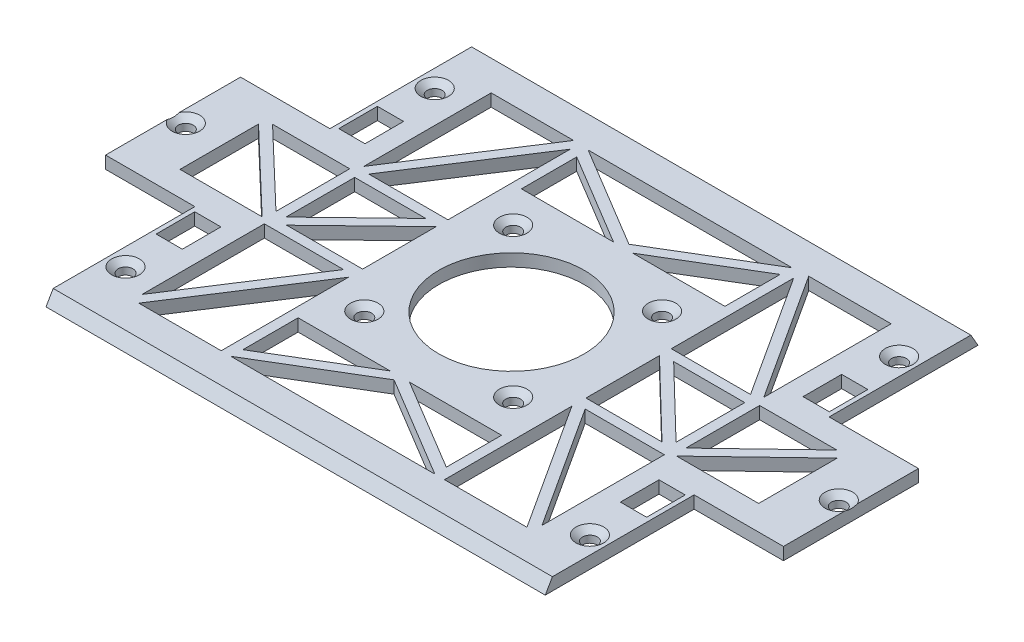
from build123d import *

# Parameters (mm, degrees)
SKETCH1_R                                         = 18.5801
BOSS_EXTRUDE1_DEPTH                               = 3.175
CSK_FOR_6_FLAT_HEAD_MACHINE_SCREW_100_D           = 3.7973
CSK_FOR_6_FLAT_HEAD_MACHINE_SCREW_100_CSINK_D     = 7.0866
CSK_FOR_6_FLAT_HEAD_MACHINE_SCREW_100_CSINK_ANGLE = 100
CUT_EXTRUDE2_DEPTH                                = 114.138623562
SKETCH7_W                                         = 6.7056
SKETCH7_H                                         = 9.8806
CUT_EXTRUDE5_DEPTH                                = 114.138623562


with BuildPart() as part:
    # Sketch1 → Boss-Extrude1 (new body)
    with BuildSketch(Plane(origin=(0, 0, 0), x_dir=(1, 0, 0), z_dir=(0, 1, 0))):
        Polygon((-65.455327335, 70.644677608), (62.306672665, 70.644677608), (62.306672665, 32.544677608), (85.166672665, 32.544677608), (85.166672665, -1.999322392), (62.306672665, -1.999322392), (62.306672665, -40.099322392), (-65.455327335, -40.099322392), (-65.455327335, -1.999322392), (-88.315327335, -1.999322392), (-88.315327335, 32.544677608), (-65.455327335, 32.544677608), align=None)
        with Locations(Location((-1.574327335, 15.145677608, 0), (0, 0, 270))):
            Circle(SKETCH1_R, mode=Mode.SUBTRACT)
    extrude(amount=BOSS_EXTRUDE1_DEPTH)

    # CSK for #6 Flat Head Machine Screw (100)1 (through all)
    with Locations(Plane(origin=(0, 3.175, 0), x_dir=(1, 0, 0), z_dir=(0, 1, 0))):
        with Locations((-60.978577335, 54.896669208), (-85.108577335, 15.336169208), (-60.978577335, -24.224330792), (57.861672665, -24.224322392), (81.991672665, 15.336177608), (57.861672665, 54.896677608), (-20.608452335, 34.608427608), (-20.608452335, -3.491572392), (17.491547665, -3.491572392), (17.491547665, 34.608427608)):
            CounterSinkHole(CSK_FOR_6_FLAT_HEAD_MACHINE_SCREW_100_D / 2, CSK_FOR_6_FLAT_HEAD_MACHINE_SCREW_100_CSINK_D / 2, counter_sink_angle=CSK_FOR_6_FLAT_HEAD_MACHINE_SCREW_100_CSINK_ANGLE)

    # Sketch4 → Cut-Extrude2 (cut, symmetric)
    with BuildSketch(Plane(origin=(0, 0, 0), x_dir=(0, 0, -1), z_dir=(1, 0, 0))):
        Polygon((70.644677608, 0), (68.811590503, 3.175), (70.644677608, 3.175), align=None)
    cut_extrude2 = extrude(amount=CUT_EXTRUDE2_DEPTH, both=True, mode=Mode.SUBTRACT)

    # Mirror1: Cut-Extrude2 across plane
    add(cut_extrude2.mirror(Plane.XY.offset(-15.272677608)), mode=Mode.SUBTRACT)

    # Sketch7 → Cut-Extrude5 (cut, through all)
    with BuildSketch(Plane(origin=(0, 3.175, 0), x_dir=(1, 0, 0), z_dir=(0, 1, 0))):
        Polygon((-31.662153757, 61.119677608), (-52.755327335, 61.119677608), (-52.755327335, 28.53190944), align=None)
        Polygon((-30.149327335, 58.782445776), (-50.420464549, 27.464677608), (-30.149327335, 27.464677608), align=None)
        Polygon((-54.025327335, 7.320825628), (-54.025327335, 26.194677608), (-73.777032895, 26.194677608), align=None)
        Polygon((-27.609327335, 60.865677608), (-27.609327335, 60.822739389), (-1.574327335, 45.201739389), (-1.574327335, 60.865677608), align=None)
        Polygon((-30.149327335, 5.620677608), (-30.149327335, 24.428637467), (-49.613378817, 5.620677608), align=None)
        Polygon((-33.291275852, 24.924677608), (-51.485327335, 24.924677608), (-51.485327335, 7.34390876), align=None)
        Polygon((-27.609327335, 57.860615827), (-27.609327335, 43.720677608), (-4.042763637, 43.720677608), align=None)
        Polygon((-54.593621774, 4.350677608), (-75.615327335, 24.438085143), (-75.615327335, 4.350677608), align=None)
        Polygon((-32.48419012, 3.080677608), (-52.755327335, 3.080677608), (-52.755327335, -28.23709056), align=None)
        Polygon((-30.149327335, -30.574322392), (-30.149327335, 2.013445776), (-51.242500913, -30.574322392), align=None)
        Polygon((-4.042763637, -13.429322392), (-27.609327335, -13.429322392), (-27.609327335, -27.569260611), align=None)
        Polygon((-27.609327335, -30.531384173), (-27.609327335, -30.574322392), (-1.574327335, -30.574322392), (-1.574327335, -14.910384173), align=None)
        with Locations((-60.978577335, -8.099133955)):
            Rectangle(SKETCH7_W, SKETCH7_H)
        with Locations((-60.978577335, 38.644472371)):
            Rectangle(SKETCH7_W, SKETCH7_H)
    cut_extrude5 = extrude(amount=-CUT_EXTRUDE5_DEPTH, mode=Mode.SUBTRACT)

    # Mirror3: Cut-Extrude5 across plane
    add(cut_extrude5.mirror(Plane(origin=(-1.574327335, 0, 0), x_dir=(0, 0, 1), z_dir=(1, 0, 0))), mode=Mode.SUBTRACT)


solid = part.part
